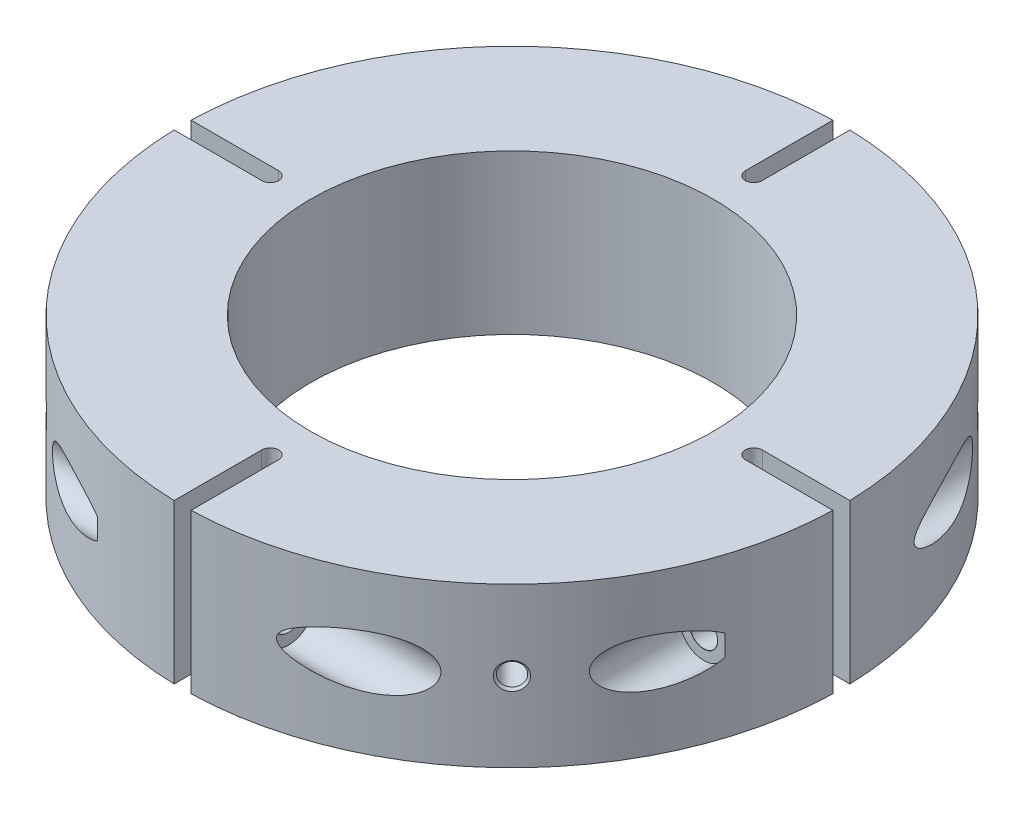
from build123d import *

# Parameters (mm, degrees)
IZIM1_R                                       = 38
Y_KSEKLIK_EKSTR_ZYON1_DEPTH                   = 30
KES_EKSTR_ZYON4_START                         = -57
IZIM31_R                                      = 4.5
KES_EKSTR_ZYON4_DEPTH                         = 40
DAIRESEL_KAPLAMA1_COUNT                       = 4
DAIRESEL_KAPLAMA2_COUNT                       = 3
DAIRESEL_KAPLAMA2_ANGLE                       = 180
M4X0_7_HELISARMAL_IN_DI_LI_DELIK1_D           = 4.2
M4X0_7_HELISARMAL_IN_DI_LI_DELIK1_DEPTH       = 10.2
M4X0_7_HELISARMAL_IN_DI_LI_DELIK1_CSINK_D     = 5.057
M4X0_7_HELISARMAL_IN_DI_LI_DELIK1_CSINK_ANGLE = 90
M4X0_7_HELISARMAL_IN_DI_LI_DELIK1_TIP         = 0.764337492


with BuildPart() as part:
    # Çizim1 → Yükseklik-Ekstrüzyon1 (new body)
    with BuildSketch(Plane(origin=(0, 0, 0), x_dir=(1, 0, 0), z_dir=(0, 1, 0))):
        with BuildLine():
            Line((-1.6, 45.679417817), (-1.6, 62.179417817))
            ThreePointArc((-1.6, 62.179417817), (-43.98204179, 43.98204179), (-62.179417817, 1.6))
            Line((-62.179417817, 1.6), (-45.679417817, 1.6))
            ThreePointArc((-45.679417817, 1.6), (-44.036235955, 0), (-45.679417817, -1.6))
            Line((-45.679417817, -1.6), (-62.179417817, -1.6))
            ThreePointArc((-62.179417817, -1.6), (-43.98204179, -43.98204179), (-1.6, -62.179417817))
            Line((-1.6, -62.179417817), (-1.6, -45.679417817))
            ThreePointArc((-1.6, -45.679417817), (0, -44.036235955), (1.6, -45.679417817))
            Line((1.6, -45.679417817), (1.6, -62.179417817))
            ThreePointArc((1.6, -62.179417817), (43.98204179, -43.98204179), (62.179417817, -1.6))
            Line((62.179417817, -1.6), (45.679417817, -1.6))
            ThreePointArc((45.679417817, -1.6), (44.036235955, 0), (45.679417817, 1.6))
            Line((45.679417817, 1.6), (62.179417817, 1.6))
            ThreePointArc((62.179417817, 1.6), (43.98204179, 43.98204179), (1.6, 62.179417817))
            Line((1.6, 62.179417817), (1.6, 45.679417817))
            ThreePointArc((1.6, 45.679417817), (0, 44.036235955), (-1.6, 45.679417817))
        make_face()
        with Locations(Location((0, 0, 0), (0, 0, 270))):
            Circle(IZIM1_R, mode=Mode.SUBTRACT)
    extrude(amount=Y_KSEKLIK_EKSTR_ZYON1_DEPTH)

    # Çizim3 → M5 Altıgen Alyan Başlı Kör Vida İçin Havşa1 (revolve, cut)
    with BuildSketch(Plane(origin=(-55.179417817, 15.156467904, 38), x_dir=(0, -1, 0), z_dir=(1, 0, 0))):
        Polygon((0, 0), (0, 39.742495795), (2.9, 38), (2.9, 25), (5, 25), (5, 0.025), (5.025, 0), align=None)
    m5_alt_gen_alyan_ba_l_k_r_vida_in_hav = revolve(axis=Axis((-55.179417817, 15.156467904, 44.35), (0, 0, -1)), mode=Mode.SUBTRACT)

    # Çizim31 → Kes-Ekstrüzyon4 (cut)
    with BuildSketch(Plane.XY.offset(38).offset(KES_EKSTR_ZYON4_START)):
        with Locations((-55.179417817, 15.156467904)):
            Circle(IZIM31_R)
    kes_ekstr_zyon4 = extrude(amount=-KES_EKSTR_ZYON4_DEPTH, mode=Mode.SUBTRACT)

    # Çizim6 → M5 Helisarmal için Zıvana matkabı3 (revolve, cut)
    with BuildSketch(Plane(origin=(-55.179417817, 15.156467904, -19), x_dir=(0, 1, 0), z_dir=(1, 0, 0))):
        Polygon((0, 0), (0, 19.562237609), (2.6, 18), (2.6, 0.025), (2.625, 0), align=None)
    m5_helisarmal_i_in_z_vana_matkab_3 = revolve(axis=Axis((-55.179417817, 15.156467904, -25.35), (0, 0, 1)), mode=Mode.SUBTRACT)

    # Çizim8 → M5x0.8 Helisarmal İçin Dişli Delik1 (revolve, cut)
    with BuildSketch(Plane(origin=(-43.98204179, 15, 43.98204179), x_dir=(0.7071067811865492, 0, 0.7071067811865459), z_dir=(0, 1, 0))):
        Polygon((0, 0), (0, 13.246322609), (2.6, 12.3), (2.6, 0.4975), (3.0975, 0), align=None)
    m5x0_8_helisarmal_in_di_li_delik1 = revolve(axis=Axis((-48.47216985, 15, 48.47216985), (0.7071067811865458, 0, -0.7071067811865492)), mode=Mode.SUBTRACT)

    # Dairesel Kaplama1: M5 Altıgen Alyan Başlı Kör Vida İçin Havşa1, Kes-Ekstrüzyon4, M5 Helisarmal için Zıvana matkabı3 ×4 about axis
    dairesel_kaplama1_axis = Axis((0, 0, 0), (0, 1, 0))
    add([m5_alt_gen_alyan_ba_l_k_r_vida_in_hav.rotate(dairesel_kaplama1_axis, i * 360 / DAIRESEL_KAPLAMA1_COUNT) for i in range(1, DAIRESEL_KAPLAMA1_COUNT)], mode=Mode.SUBTRACT)
    add([kes_ekstr_zyon4.rotate(dairesel_kaplama1_axis, i * 360 / DAIRESEL_KAPLAMA1_COUNT) for i in range(1, DAIRESEL_KAPLAMA1_COUNT)], mode=Mode.SUBTRACT)
    add([m5_helisarmal_i_in_z_vana_matkab_3.rotate(dairesel_kaplama1_axis, i * 360 / DAIRESEL_KAPLAMA1_COUNT) for i in range(1, DAIRESEL_KAPLAMA1_COUNT)], mode=Mode.SUBTRACT)

    # Dairesel Kaplama2: M5x0.8 Helisarmal İçin Dişli Delik1 ×3 about axis
    dairesel_kaplama2_axis = Axis((0, 30, 0), (0, -1, 0))
    for i in range(1, DAIRESEL_KAPLAMA2_COUNT):
        add(m5x0_8_helisarmal_in_di_li_delik1.rotate(dairesel_kaplama2_axis, i * DAIRESEL_KAPLAMA2_ANGLE / (DAIRESEL_KAPLAMA2_COUNT - 1)), mode=Mode.SUBTRACT)

    # M4x0.7 Helisarmal İçin Dişli Delik1
    with Locations(Plane(origin=(43.98204179, 15, 43.98204179), x_dir=(-0.707106781187, 0, 0.707106781187), z_dir=(0.707106781187, 0, 0.707106781187))):
        with Locations((0, 0)):
            CounterSinkHole(M4X0_7_HELISARMAL_IN_DI_LI_DELIK1_D / 2, M4X0_7_HELISARMAL_IN_DI_LI_DELIK1_CSINK_D / 2, depth=M4X0_7_HELISARMAL_IN_DI_LI_DELIK1_DEPTH, counter_sink_angle=M4X0_7_HELISARMAL_IN_DI_LI_DELIK1_CSINK_ANGLE)
            with Locations((0, 0, -(M4X0_7_HELISARMAL_IN_DI_LI_DELIK1_DEPTH + M4X0_7_HELISARMAL_IN_DI_LI_DELIK1_TIP / 2))):  # 140° drill point
                Cone(0, M4X0_7_HELISARMAL_IN_DI_LI_DELIK1_D / 2, M4X0_7_HELISARMAL_IN_DI_LI_DELIK1_TIP, mode=Mode.SUBTRACT)


solid = part.part
